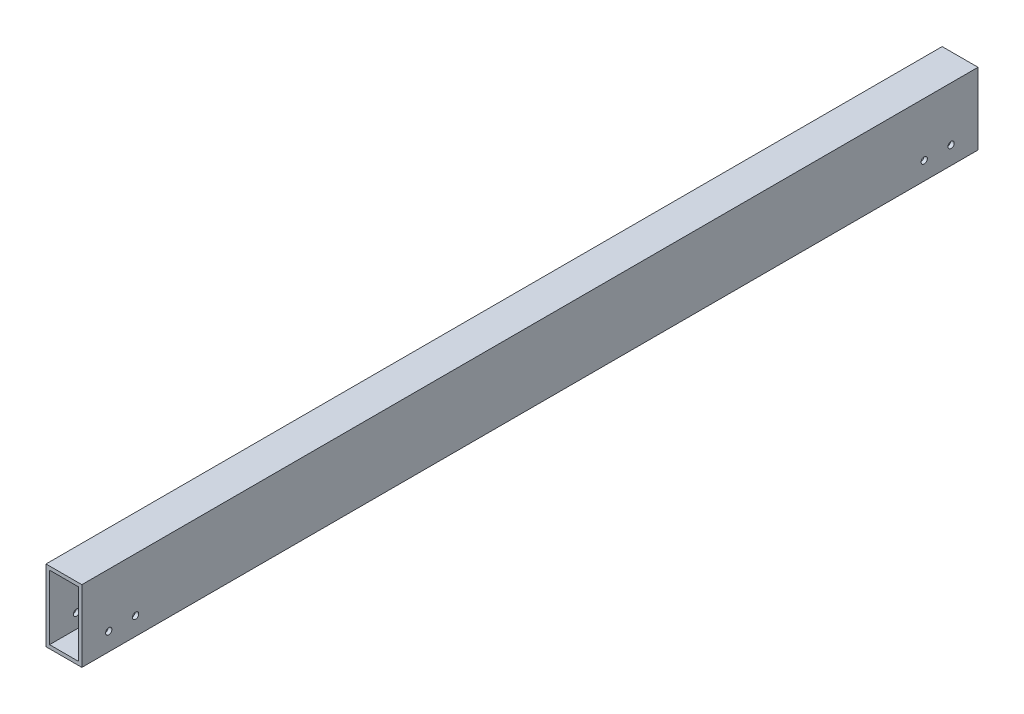
from build123d import *

# Parameters (mm, degrees)
ESBO_O1_W                = 20
ESBO_O1_H                = 40
ESBO_O1_W_2              = 16
ESBO_O1_H_2              = 36
RESSALTO_EXTRUS_O1_DEPTH = 500
ESBO_O2_R                = 1.75
CORTE_EXTRUS_O1_DEPTH    = 2
CORTE_EXTRUS_O2_START    = -2
ESBO_O5_R                = 1.75
CORTE_EXTRUS_O2_DEPTH    = 2


with BuildPart() as part:
    # Esboço1 → Ressalto-extrusão1 (new body)
    with BuildSketch(Plane.XY):
        with Locations((10, 20)):
            Rectangle(ESBO_O1_W, ESBO_O1_H)
        with Locations((10, 20)):
            Rectangle(ESBO_O1_W_2, ESBO_O1_H_2, mode=Mode.SUBTRACT)
    extrude(amount=RESSALTO_EXTRUS_O1_DEPTH)

    # Esboço2 → Corte-extrusão1 (cut)
    with BuildSketch(Plane.ZY):
        with Locations((15, 10)):
            Circle(ESBO_O2_R)
        with Locations((30, 10)):
            Circle(ESBO_O2_R)
        with Locations(Location((485, 10, 0), (0, 0, 180))):
            Circle(ESBO_O2_R)
        with Locations(Location((470, 10, 0), (0, 0, 180))):
            Circle(ESBO_O2_R)
    extrude(amount=-CORTE_EXTRUS_O1_DEPTH, mode=Mode.SUBTRACT)

    # Esboço5 → Corte-extrusão2 (cut)
    with BuildSketch(Plane(origin=(20, 0, 0), x_dir=(0, 0, -1), z_dir=(1, 0, 0)).offset(CORTE_EXTRUS_O2_START)):
        with Locations(Location((-15, 10, 0), (0, 0, 180))):
            Circle(ESBO_O5_R)
        with Locations(Location((-30, 10, 0), (0, 0, 180))):
            Circle(ESBO_O5_R)
        with Locations((-485, 10)):
            Circle(ESBO_O5_R)
        with Locations((-470, 10)):
            Circle(ESBO_O5_R)
    extrude(amount=CORTE_EXTRUS_O2_DEPTH, mode=Mode.SUBTRACT)


solid = part.part
